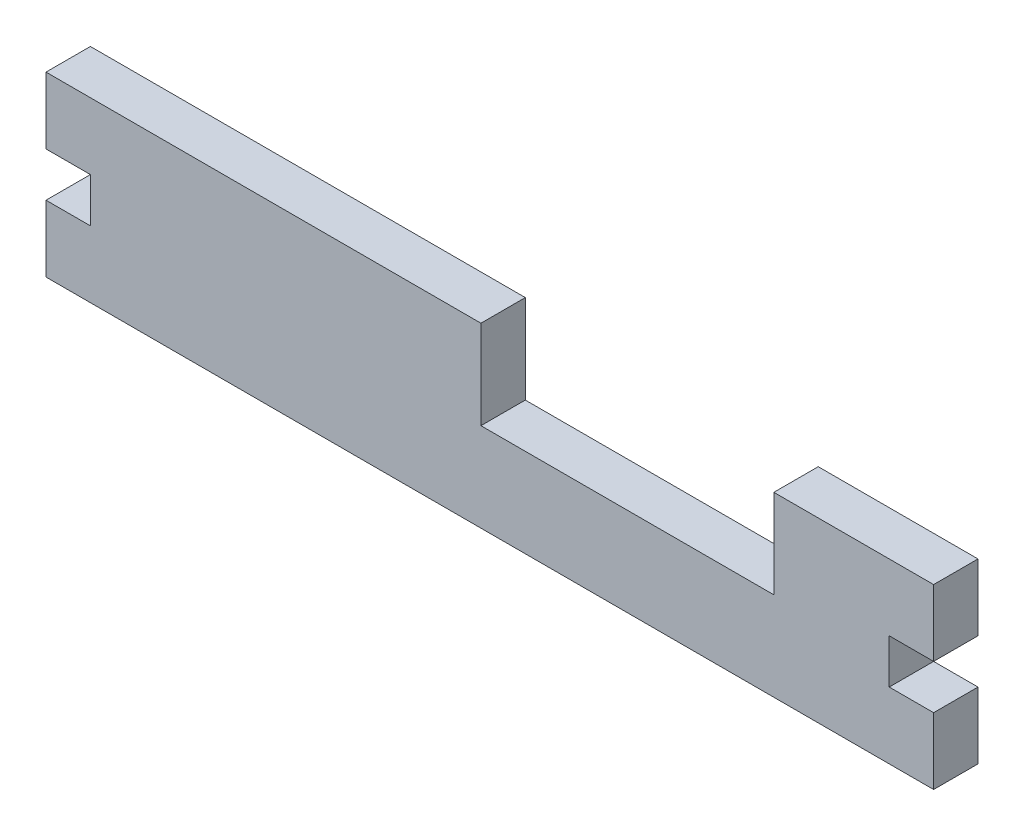
from build123d import *

# Parameters (mm, degrees)
BOSS_EXTRU_1_DEPTH = 5


with BuildPart() as part:
    # Esquisse1 → Boss.-Extru.1 (new body)
    with BuildSketch(Plane.XY):
        Polygon((0, 0), (90, 0), (95, 0), (95, 7.5), (90, 7.5), (90, 12.5), (95, 12.5), (95, 20), (90, 20), (77, 20), (77, 10), (44, 10), (44, 20), (0, 20), (-5, 20), (-5, 12.5), (0, 12.5), (0, 7.5), (-5, 7.5), (-5, 0), align=None)
    extrude(amount=BOSS_EXTRU_1_DEPTH)


solid = part.part
